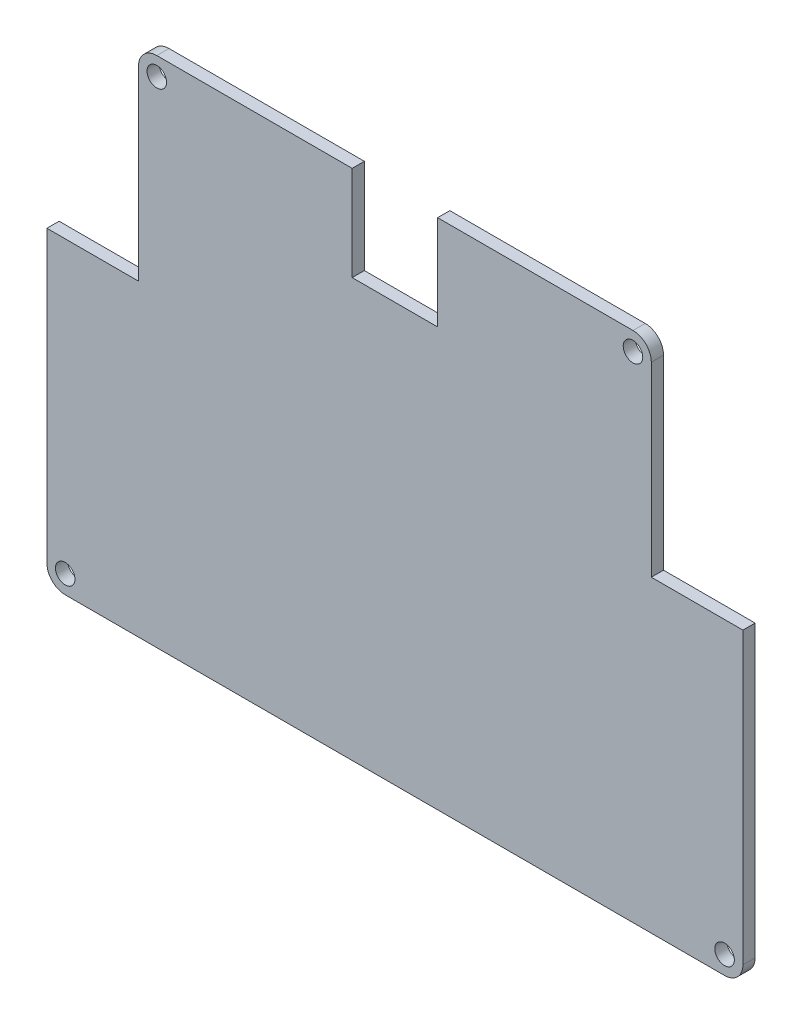
from build123d import *

# Parameters (mm, degrees)
SKETCH1_R           = 1.6
BOSS_EXTRUDE1_DEPTH = 2


with BuildPart() as part:
    # Sketch1 → Boss-Extrude1 (new body)
    with BuildSketch(Plane.XY):
        with BuildLine():
            Line((-42, 25.469603275), (-57, 25.469603275))
            Line((-57, 25.469603275), (-57, -22.030396725))
            ThreePointArc((-57, -22.030396725), (-56.121320344, -24.151717068), (-54, -25.030396725))
            Line((-54, -25.030396725), (54, -25.030396725))
            ThreePointArc((54, -25.030396725), (56.121320344, -24.151717068), (57, -22.030396725))
            Line((57, -22.030396725), (57, 25.469603275))
            Line((57, 25.469603275), (42, 25.469603275))
            Line((42, 25.469603275), (42, 55.969603275))
            ThreePointArc((42, 55.969603275), (41.121320344, 58.090923619), (39, 58.969603275))
            Line((39, 58.969603275), (7, 58.969603275))
            Line((7, 58.969603275), (7, 43.469603275))
            Line((7, 43.469603275), (-7, 43.469603275))
            Line((-7, 43.469603275), (-7, 58.969603275))
            Line((-7, 58.969603275), (-39, 58.969603275))
            ThreePointArc((-39, 58.969603275), (-41.121320344, 58.090923619), (-42, 55.969603275))
            Line((-42, 55.969603275), (-42, 25.469603275))
        make_face()
        with Locations((54, -22.030396725)):
            Circle(SKETCH1_R, mode=Mode.SUBTRACT)
        with Locations(Location((-54, -22.030396725, 0), (0, 0, 180))):
            Circle(SKETCH1_R, mode=Mode.SUBTRACT)
        with Locations((39, 55.969603275)):
            Circle(SKETCH1_R, mode=Mode.SUBTRACT)
        with Locations(Location((-39, 55.969603275, 0), (0, 0, 180))):
            Circle(SKETCH1_R, mode=Mode.SUBTRACT)
    extrude(amount=BOSS_EXTRUDE1_DEPTH)


solid = part.part
